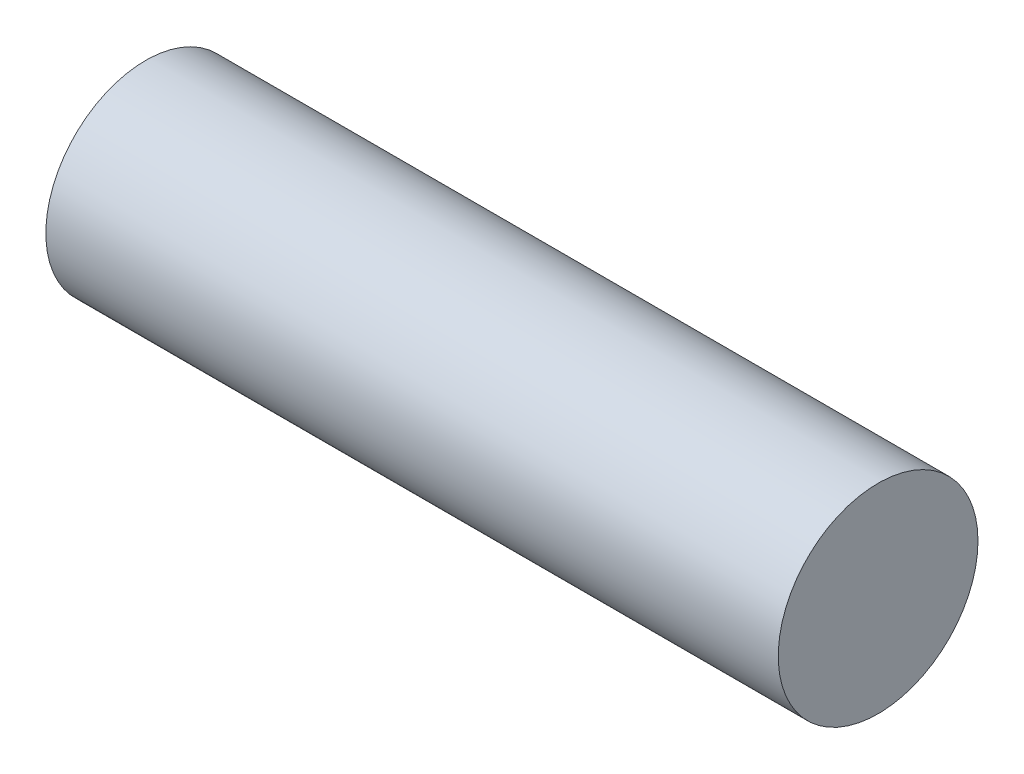
from build123d import *

# Parameters (mm, degrees)
SKETCH1_R           = 7.5
BOSS_EXTRUDE1_DEPTH = 55


with BuildPart() as part:
    # Sketch1 → Boss-Extrude1 (new body)
    with BuildSketch(Plane(origin=(0, 0, 0), x_dir=(0, 0, -1), z_dir=(1, 0, 0))):
        Circle(SKETCH1_R)
    extrude(amount=BOSS_EXTRUDE1_DEPTH)


solid = part.part
